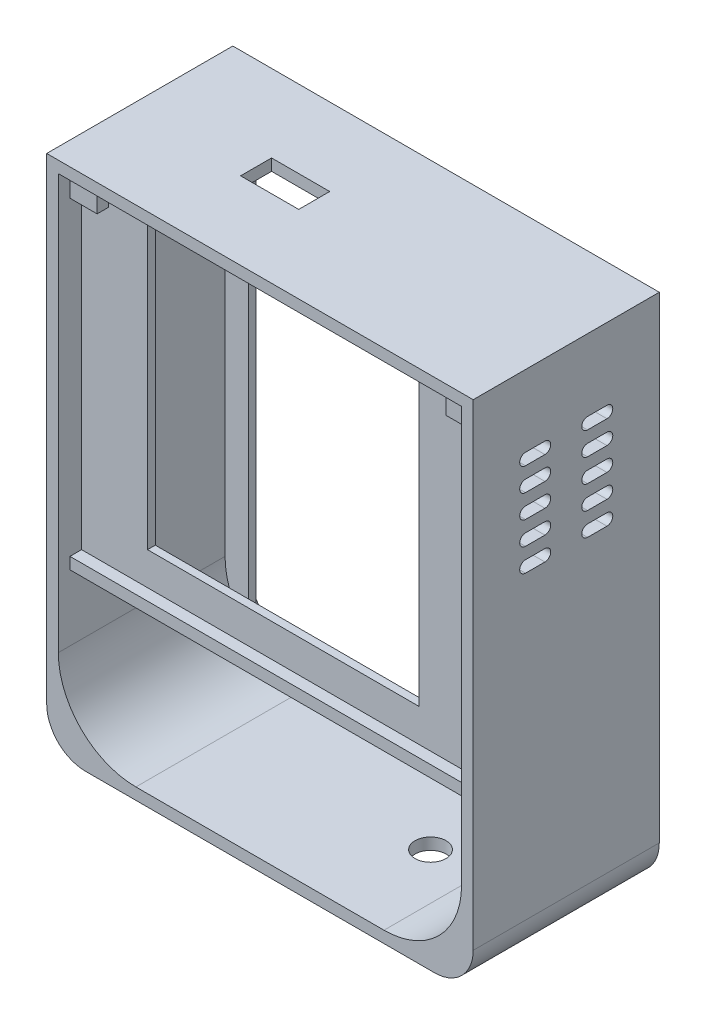
from build123d import *

# Parameters (mm, degrees)
SKETCH_1_W          = 110
SKETCH_1_H          = 133
EXTRUDE_1_DEPTH     = 48
SKETCH_2_W          = 104
SKETCH_2_H          = 127
CUT_EXTRUDE_1_DEPTH = 50
SKETCH_3_W          = 104
SKETCH_3_H          = 2
EXTRUDE_2_DEPTH     = 90
CUT_EXTRUDE_2_REACH = 97.975
SKETCH_4_W          = 70
SKETCH_4_H          = 70
SKETCH_5_W          = 104
SKETCH_5_H          = 3
EXTRUDE_3_DEPTH     = 3
SKETCH_6_W          = 15
SKETCH_6_H          = 8
CUT_EXTRUDE_3_DEPTH = 10
SKETCH_8_W          = 70
SKETCH_8_H          = 8.5
CUT_EXTRUDE_4_DEPTH = 2
EXTRUDE_4_REACH     = 136.816
SKETCH_9_W          = 2
SKETCH_9_H          = 127
SKETCH_10_W         = 92
SKETCH_10_H         = 115
CUT_EXTRUDE_5_DEPTH = 8
FILLET_10_R         = 10
FILLET_11_R         = 20
FILLET_12_R         = 20
FILLET_13_R         = 10
FILLET_14_R         = 20
FILLET_15_R         = 20
FILLET_16_R         = 20
SKETCH_11_W         = 7
SKETCH_11_H         = 7
EXTRUDE_5_DEPTH     = 3
SKETCH_12_R         = 4
CUT_EXTRUDE_6_DEPTH = 3
CUT_EXTRUDE_7_DEPTH = 3


with BuildPart() as part:
    # 草图1 → 凸台-拉伸1 (new body)
    with BuildSketch(Plane.XY):
        Rectangle(SKETCH_1_W, SKETCH_1_H)
    extrude(amount=EXTRUDE_1_DEPTH)

    # 草图2 → 切除-拉伸1 (cut)
    with BuildSketch(Plane.XY.offset(48)):
        Rectangle(SKETCH_2_W, SKETCH_2_H)
    extrude(amount=-CUT_EXTRUDE_1_DEPTH, mode=Mode.SUBTRACT)

    # 草图3 → 凸台-拉伸2 (add)
    with BuildSketch(Plane.XZ.offset(-63.5)):
        with Locations((0, 41)):
            Rectangle(SKETCH_3_W, SKETCH_3_H)
    extrude(amount=EXTRUDE_2_DEPTH)

    # 草图4 → 切除-拉伸2 (cut, up to next)
    with BuildSketch(Plane.XY.offset(42), mode=Mode.PRIVATE) as cut_extrude_2_sk1:
        with Locations((0, 20)):
            Rectangle(SKETCH_4_W, SKETCH_4_H)
    cut_extrude_2_tool1 = extrude(cut_extrude_2_sk1.sketch, amount=-CUT_EXTRUDE_2_REACH, mode=Mode.PRIVATE) & part.part
    add(cut_extrude_2_tool1.solids().sort_by_distance((0, 20, 42))[0], mode=Mode.SUBTRACT)

    # 草图5 → 凸台-拉伸3 (add)
    with BuildSketch(Plane.XY.offset(42)):
        with Locations((0, -25)):
            Rectangle(SKETCH_5_W, SKETCH_5_H)
    extrude(amount=EXTRUDE_3_DEPTH)

    # 草图6 → 切除-拉伸3 (cut)
    with BuildSketch(Plane(origin=(0, 66.5, 0), x_dir=(1, 0, 0), z_dir=(0, 1, 0))):
        with Locations((-17.5, -24)):
            Rectangle(SKETCH_6_W, SKETCH_6_H)
    extrude(amount=-CUT_EXTRUDE_3_DEPTH, mode=Mode.SUBTRACT)

    # 草图8 → 切除-拉伸4 (cut)
    with BuildSketch(Plane.XY.offset(42)):
        with Locations((0, 59.25)):
            Rectangle(SKETCH_8_W, SKETCH_8_H)
    extrude(amount=-CUT_EXTRUDE_4_DEPTH, mode=Mode.SUBTRACT)

    # 草图9 → 凸台-拉伸4 (add, up to next)
    with BuildSketch(Plane.ZY.offset(-52), mode=Mode.PRIVATE) as extrude_4_sk1:
        with Locations((4, 0)):
            Rectangle(SKETCH_9_W, SKETCH_9_H)
    extrude_4_tool1 = extrude(extrude_4_sk1.sketch, amount=EXTRUDE_4_REACH, mode=Mode.PRIVATE) - part.part
    add(extrude_4_tool1.solids().sort_by_distance((52, 0, 4))[0])

    # 草图10 → 切除-拉伸5 (cut)
    with BuildSketch(Plane(origin=(0, 0, 3), x_dir=(-1, 0, 0), z_dir=(0, 0, -1))):
        Rectangle(SKETCH_10_W, SKETCH_10_H)
    extrude(amount=-CUT_EXTRUDE_5_DEPTH, mode=Mode.SUBTRACT)

    # 圆角10
    fillet_10_edges = [part.edges().sort_by_distance(p)[0] for p in [
        (-55, -66.5, 24),
    ]]
    fillet(fillet_10_edges, radius=FILLET_10_R)

    # 圆角11
    fillet_11_edges = [part.edges().sort_by_distance(p)[0] for p in [
        (-52, -63.5, 1.5),
    ]]
    fillet(fillet_11_edges, radius=FILLET_11_R)

    # 圆角12
    fillet_12_edges = [part.edges().sort_by_distance(p)[0] for p in [
        (52, -63.5, 1.5),
    ]]
    fillet(fillet_12_edges, radius=FILLET_12_R)

    # 圆角13
    fillet_13_edges = [part.edges().sort_by_distance(p)[0] for p in [
        (55, -66.5, 24),
    ]]
    fillet(fillet_13_edges, radius=FILLET_13_R)

    # 圆角14
    fillet_14_edges = [part.edges().sort_by_distance(p)[0] for p in [
        (-52, 63.5, 1.5),
        (52, 63.5, 1.5),
    ]]
    fillet(fillet_14_edges, radius=FILLET_14_R)

    # 圆角15
    fillet_15_edges = [part.edges().sort_by_distance(p)[0] for p in [
        (52, -63.5, 26.5),
    ]]
    fillet(fillet_15_edges, radius=FILLET_15_R)

    # 圆角16
    fillet_16_edges = [part.edges().sort_by_distance(p)[0] for p in [
        (-52, -63.5, 26.5),
    ]]
    fillet(fillet_16_edges, radius=FILLET_16_R)

    # 草图11 → 凸台-拉伸5 (add)
    with BuildSketch(Plane.XY.offset(42)):
        with Locations((48.5, 60)):
            Rectangle(SKETCH_11_W, SKETCH_11_H)
        with Locations((-48.5, 60)):
            Rectangle(SKETCH_11_W, SKETCH_11_H)
    extrude(amount=EXTRUDE_5_DEPTH)

    # 草图12 → 切除-拉伸6 (cut)
    with BuildSketch(Plane.XZ.offset(66.5)):
        with Locations(Location((20, 24, 0), (0, 0, 270))):
            Circle(SKETCH_12_R)
    extrude(amount=-CUT_EXTRUDE_6_DEPTH, mode=Mode.SUBTRACT)

    # 草图13 → 切除-拉伸7 (cut)
    with BuildSketch(Plane.ZY.offset(-52)):
        with BuildLine():
            Line((13.5, 48), (18.5, 48))
            ThreePointArc((18.5, 48), (20, 46.5), (18.5, 45))
            Line((18.5, 45), (13.5, 45))
            ThreePointArc((13.5, 45), (12, 46.5), (13.5, 48))
        make_face()
        with BuildLine():
            Line((34.5, 48), (29.5, 48))
            ThreePointArc((29.5, 48), (28, 46.5), (29.5, 45))
            Line((29.5, 45), (34.5, 45))
            ThreePointArc((34.5, 45), (36, 46.5), (34.5, 48))
        make_face()
        with BuildLine():
            Line((13.5, 42), (18.5, 42))
            ThreePointArc((18.5, 42), (20, 40.5), (18.5, 39))
            Line((18.5, 39), (13.5, 39))
            ThreePointArc((13.5, 39), (12, 40.5), (13.5, 42))
        make_face()
        with BuildLine():
            Line((13.5, 36), (18.5, 36))
            ThreePointArc((18.5, 36), (20, 34.5), (18.5, 33))
            Line((18.5, 33), (13.5, 33))
            ThreePointArc((13.5, 33), (12, 34.5), (13.5, 36))
        make_face()
        with BuildLine():
            Line((13.5, 30), (18.5, 30))
            ThreePointArc((18.5, 30), (20, 28.5), (18.5, 27))
            Line((18.5, 27), (13.5, 27))
            ThreePointArc((13.5, 27), (12, 28.5), (13.5, 30))
        make_face()
        with BuildLine():
            Line((13.5, 24), (18.5, 24))
            ThreePointArc((18.5, 24), (20, 22.5), (18.5, 21))
            Line((18.5, 21), (13.5, 21))
            ThreePointArc((13.5, 21), (12, 22.5), (13.5, 24))
        make_face()
        with BuildLine():
            Line((34.5, 24), (29.5, 24))
            ThreePointArc((29.5, 24), (28, 22.5), (29.5, 21))
            Line((29.5, 21), (34.5, 21))
            ThreePointArc((34.5, 21), (36, 22.5), (34.5, 24))
        make_face()
        with BuildLine():
            Line((34.5, 30), (29.5, 30))
            ThreePointArc((29.5, 30), (28, 28.5), (29.5, 27))
            Line((29.5, 27), (34.5, 27))
            ThreePointArc((34.5, 27), (36, 28.5), (34.5, 30))
        make_face()
        with BuildLine():
            Line((34.5, 36), (29.5, 36))
            ThreePointArc((29.5, 36), (28, 34.5), (29.5, 33))
            Line((29.5, 33), (34.5, 33))
            ThreePointArc((34.5, 33), (36, 34.5), (34.5, 36))
        make_face()
        with BuildLine():
            Line((34.5, 42), (29.5, 42))
            ThreePointArc((29.5, 42), (28, 40.5), (29.5, 39))
            Line((29.5, 39), (34.5, 39))
            ThreePointArc((34.5, 39), (36, 40.5), (34.5, 42))
        make_face()
    extrude(amount=-CUT_EXTRUDE_7_DEPTH, mode=Mode.SUBTRACT)


solid = part.part
